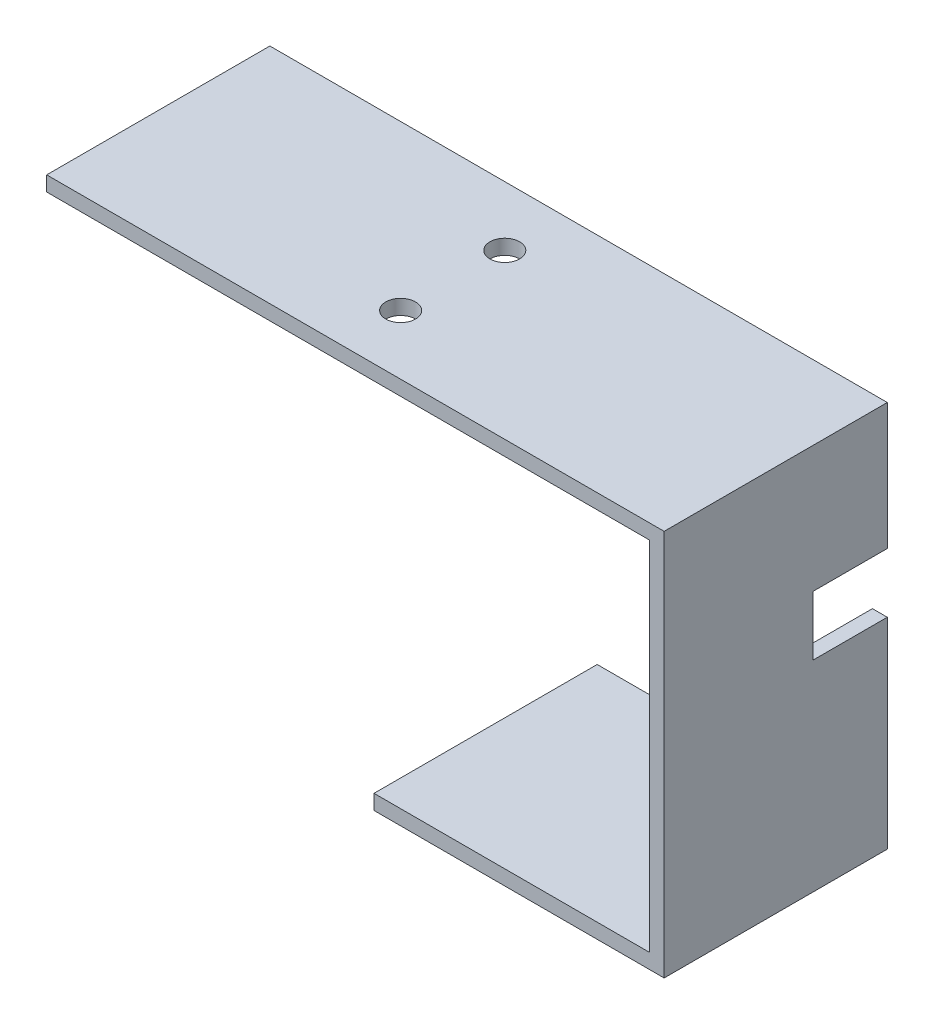
from build123d import *

# Parameters (mm, degrees)
EXTRUDE_1_DEPTH     = 30
SKETCH_3_W          = 10
SKETCH_3_H          = 8
CUT_EXTRUDE_1_DEPTH = 30
SKETCH_4_R          = 2
CUT_EXTRUDE_2_DEPTH = 10


with BuildPart() as part:
    # 草图2 → 拉伸-薄壁1 (new body)
    with BuildSketch(Plane.XY):
        Polygon((-81, 0), (0, 0), (0, -48), (-37, -48), (-37, -50), (2, -50), (2, 2), (-81, 2), align=None)
    extrude(amount=EXTRUDE_1_DEPTH)

    # 草图3 → 切除-拉伸1 (cut)
    with BuildSketch(Plane(origin=(2, 0, 0), x_dir=(0, 0, -1), z_dir=(1, 0, 0))):
        with Locations((-5, -19)):
            Rectangle(SKETCH_3_W, SKETCH_3_H)
    extrude(amount=-CUT_EXTRUDE_1_DEPTH, mode=Mode.SUBTRACT)

    # 草图4 → 切除-拉伸2 (cut)
    with BuildSketch(Plane(origin=(0, 2, 0), x_dir=(1, 0, 0), z_dir=(0, 1, 0))):
        with Locations(Location((-41.420164834, -8, 0), (0, 0, 270))):
            Circle(SKETCH_4_R)
        with Locations(Location((-41.420164834, -22, 0), (0, 0, 270))):
            Circle(SKETCH_4_R)
    extrude(amount=-CUT_EXTRUDE_2_DEPTH, mode=Mode.SUBTRACT)


solid = part.part
